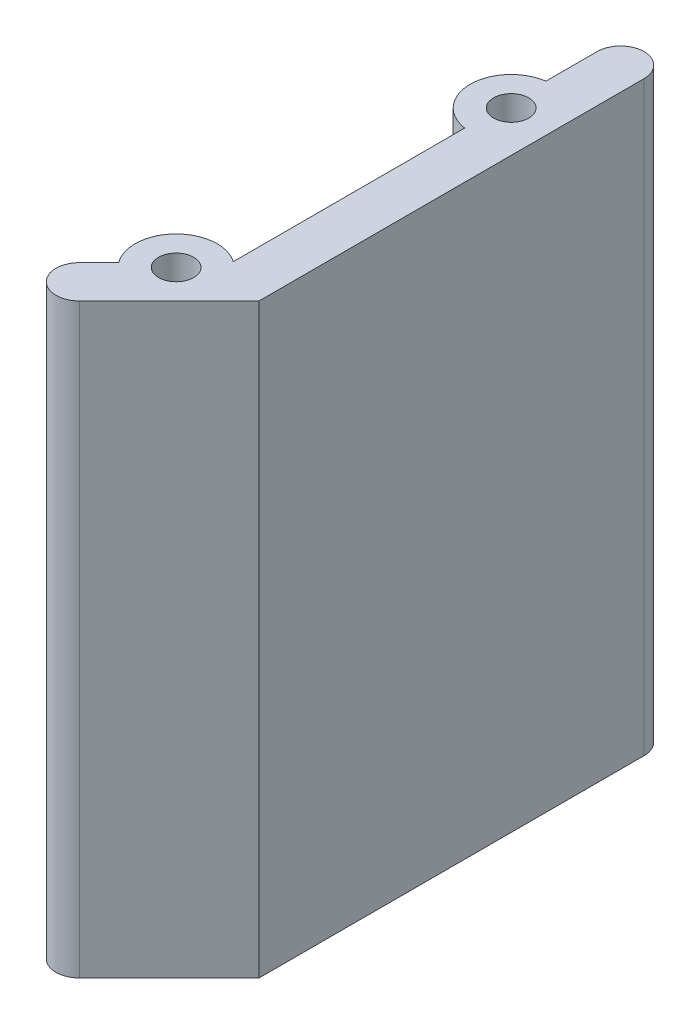
from build123d import *

# Parameters (mm, degrees)
BOSS_EXTRUDE1_DEPTH = 50
SKETCH5_R           = 3.5
SKETCH5_R_2         = 1.5
BOSS_EXTRUDE2_DEPTH = 50
SKETCH6_R           = 1.5
CUT_EXTRUDE1_DEPTH  = 10
CUT_EXTRUDE2_START  = -10
SKETCH7_R           = 1.5
CUT_EXTRUDE2_DEPTH  = 10


with BuildPart() as part:
    # Sketch1 → Boss-Extrude1 (new body)
    with BuildSketch(Plane(origin=(0, 0, 0), x_dir=(1, 0, 0), z_dir=(0, 1, 0))):
        with BuildLine():
            Line((-2, 32), (-2, 0.828427125))
            Line((-2, 0.828427125), (-8.485281374, -5.656854249))
            ThreePointArc((-8.485281374, -5.656854249), (-8.485281374, -8.485281374), (-5.656854249, -8.485281374))
            Line((-5.656854249, -8.485281374), (2, -0.828427125))
            Line((2, -0.828427125), (2, 32))
            ThreePointArc((2, 32), (0, 34), (-2, 32))
        make_face()
    extrude(amount=BOSS_EXTRUDE1_DEPTH)

    # Sketch5 → Boss-Extrude2 (add, through all)
    # profile 1 of 2: a face of its own
    with BuildSketch(Plane(origin=(0, 0, 0), x_dir=(-1, 0, 0), z_dir=(0, -1, 0))):
        with Locations((1.5, 24.171572875)):
            Circle(SKETCH5_R)
        with Locations((1.5, 24.171572875)):
            Circle(SKETCH5_R_2, mode=Mode.SUBTRACT)
    # profile 2 of 2: a face of its own
    with BuildSketch(Plane(origin=(0, 0, 0), x_dir=(-1, 0, 0), z_dir=(0, -1, 0))):
        with Locations((4.01040764, -1.889087297)):
            Circle(SKETCH5_R)
        with Locations((4.01040764, -1.889087297)):
            Circle(SKETCH5_R_2, mode=Mode.SUBTRACT)
    extrude(amount=-BOSS_EXTRUDE2_DEPTH)

    # Sketch6 → Cut-Extrude1 (cut)
    with BuildSketch(Plane(origin=(0, 0, 0), x_dir=(-1, 0, 0), z_dir=(0, -1, 0))):
        with Locations(Location((4.01040764, -1.889087297, 0), (0, 0, 90))):
            Circle(SKETCH6_R)
        with Locations(Location((1.5, 24.171572875, 0), (0, 0, 90))):
            Circle(SKETCH6_R)
    extrude(amount=-CUT_EXTRUDE1_DEPTH, mode=Mode.SUBTRACT)

    # Sketch7 → Cut-Extrude2 (cut)
    with BuildSketch(Plane(origin=(0, 50, 0), x_dir=(1, 0, 0), z_dir=(0, 1, 0)).offset(CUT_EXTRUDE2_START)):
        with Locations(Location((-4.01040764, -1.889087297, 0), (0, 0, 90))):
            Circle(SKETCH7_R)
        with Locations(Location((-1.5, 24.171572875, 0), (0, 0, 90))):
            Circle(SKETCH7_R)
    extrude(amount=CUT_EXTRUDE2_DEPTH, mode=Mode.SUBTRACT)


solid = part.part
